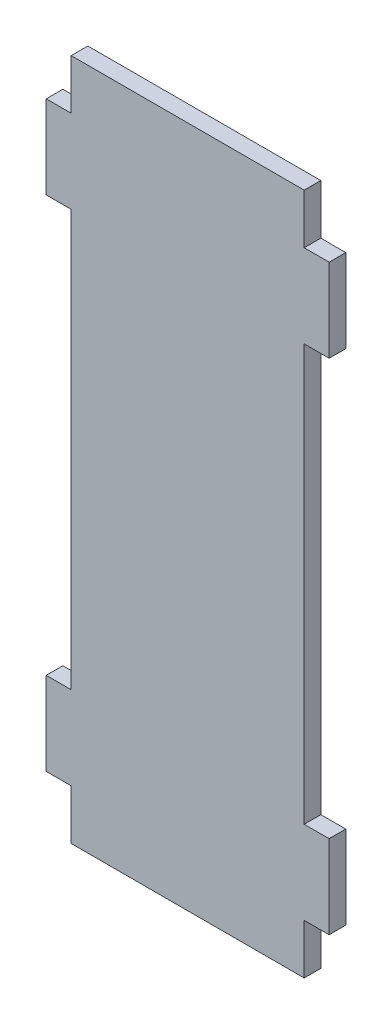
from build123d import *

# Parameters (mm, degrees)
SALIENTE_EXTRUIR1_DEPTH = 2


with BuildPart() as part:
    # Croquis1 → Saliente-Extruir1 (new body)
    with BuildSketch(Plane.XY):
        Polygon((0, 0), (0, -6), (-3, -6), (-3, -16), (0, -16), (0, -66), (-3, -66), (-3, -76), (0, -76), (0, -82), (28, -82), (28, -76), (31, -76), (31, -66), (28, -66), (28, -16), (31, -16), (31, -6), (28, -6), (28, 0), align=None)
    extrude(amount=-SALIENTE_EXTRUIR1_DEPTH)


solid = part.part
